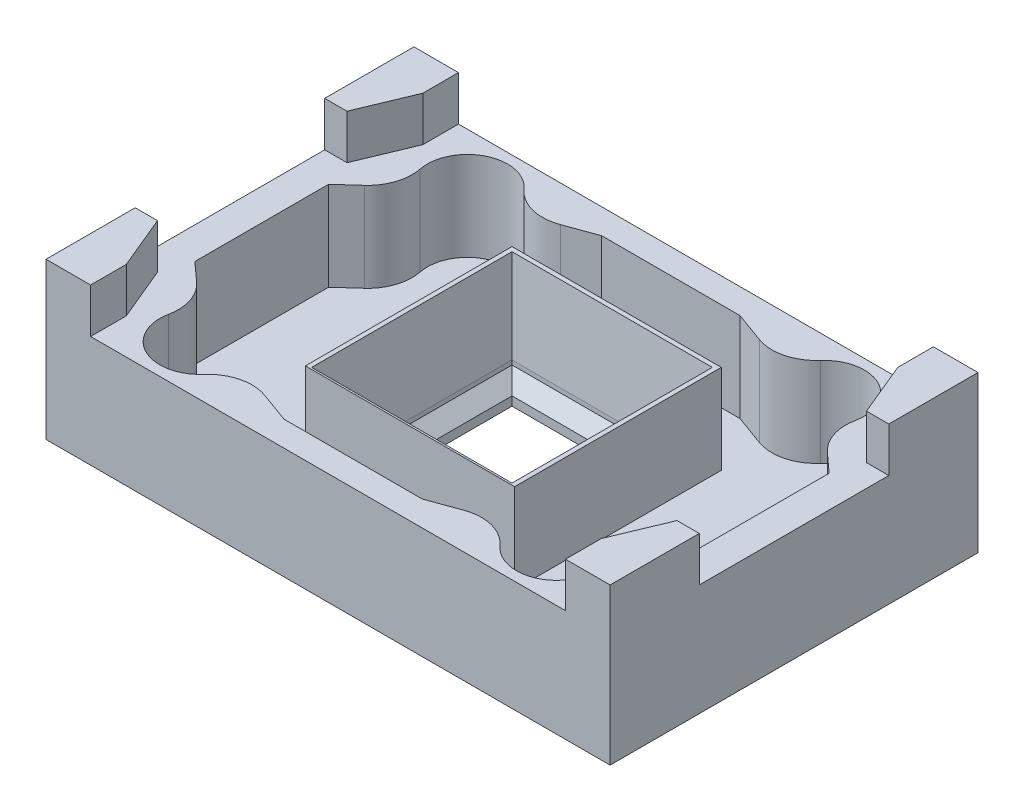
from build123d import *

# Parameters (mm, degrees)
SKETCH_1_W      = 126.5
SKETCH_1_H      = 82.5
SKETCH_1_R      = 2.1
SKETCH_1_R_2    = 1.93578743
SKETCH_1_W_2    = 34.92820323
SKETCH_1_H_2    = 34.928203231
EXTRUDE_1_DEPTH = 5
SKETCH_2_W      = 126.5
SKETCH_2_H      = 82.5
EXTRUDE_2_DEPTH = 20
FILLET_1_R      = 10
CHAMFER_1_SIZE  = 3
SKETCH_3_W      = 46.92820323
SKETCH_3_H      = 46.337518094
SKETCH_3_W_2    = 40.92820323
SKETCH_3_H_2    = 40.928203231
EXTRUDE_3_DEPTH = 20
CHAMFER_2_SIZE  = 2
CHAMFER_2_SIZE2 = 19.028728908
EXTRUDE_4_DEPTH = 10


with BuildPart() as part:
    # Эскиз1 → Бобышка-Вытянуть1 (new body)
    with BuildSketch(Plane(origin=(0, 77.195974268, 0), x_dir=(1, 0, 0), z_dir=(0, 1, 0))):
        with Locations((64.808980694, -89.523129836)):
            Rectangle(SKETCH_1_W, SKETCH_1_H)
        with Locations(Location((24.808980694, -59.523129836, 0), (0, 0, 180))):
            Circle(SKETCH_1_R, mode=Mode.SUBTRACT)
        with Locations(Location((104.808980694, -59.523129836, 0), (0, 0, 180))):
            Circle(SKETCH_1_R, mode=Mode.SUBTRACT)
        with Locations(Location((104.808980694, -119.523129836, 0), (0, 0, 180))):
            Circle(SKETCH_1_R_2, mode=Mode.SUBTRACT)
        with Locations(Location((24.808980694, -119.523129836, 0), (0, 0, 180))):
            Circle(SKETCH_1_R, mode=Mode.SUBTRACT)
        with Locations((64.808980694, -89.523129837)):
            Rectangle(SKETCH_1_W_2, SKETCH_1_H_2, mode=Mode.SUBTRACT)
    extrude(amount=EXTRUDE_1_DEPTH)

    # Эскиз2 → Бобышка-Вытянуть2 (add)
    with BuildSketch(Plane(origin=(0, 82.195974268, 0), x_dir=(1, 0, 0), z_dir=(0, 1, 0))):
        with Locations((64.808980694, -89.523129836)):
            Rectangle(SKETCH_2_W, SKETCH_2_H)
        with BuildLine():
            ThreePointArc((18.350983106, -65.791643787), (21.426820016, -51.182806752), (33.808980694, -59.523129836))
            Line((33.808980694, -59.523129836), (49.308980694, -53.898129836))
            Line((49.308980694, -53.898129836), (80.308980694, -53.898129836))
            Line((80.308980694, -53.898129836), (95.808980694, -59.523129836))
            ThreePointArc((95.808980694, -59.523129836), (104.808980694, -50.523129836), (113.808980694, -59.523129836))
            ThreePointArc((113.808980694, -59.523129836), (113.149303778, -62.905290515), (111.266978282, -65.791643787))
            Line((111.266978282, -65.791643787), (120.933980694, -74.523129836))
            Line((120.933980694, -74.523129836), (120.933980694, -104.523129836))
            Line((120.933980694, -104.523129836), (111.266978282, -113.254615886))
            ThreePointArc((111.266978282, -113.254615886), (113.149303778, -116.140969158), (113.808980694, -119.523129836))
            ThreePointArc((113.808980694, -119.523129836), (104.808980694, -128.523129836), (95.808980694, -119.523129836))
            Line((95.808980694, -119.523129836), (80.308980694, -125.148129836))
            Line((80.308980694, -125.148129836), (49.308980694, -125.148129836))
            Line((49.308980694, -125.148129836), (33.808980694, -119.523129836))
            ThreePointArc((33.808980694, -119.523129836), (21.426820016, -127.86345292), (18.350983106, -113.254615886))
            Line((18.350983106, -113.254615886), (8.683980694, -104.523129836))
            Line((8.683980694, -104.523129836), (8.683980694, -74.523129836))
            Line((8.683980694, -74.523129836), (18.350983106, -65.791643787))
        make_face(mode=Mode.SUBTRACT)
    extrude(amount=EXTRUDE_2_DEPTH)

    # Скругление1
    fillet_1_edges = [part.edges().sort_by_distance(p)[0] for p in [
        (18.350983106, 92.195974268, 65.791643787),
        (33.808980694, 92.195974268, 59.523129836),
        (95.808980694, 92.195974268, 59.523129836),
        (111.266978282, 92.195974268, 65.791643787),
        (111.266978282, 92.195974268, 113.254615886),
        (95.808980694, 92.195974268, 119.523129836),
        (33.808980694, 92.195974268, 119.523129836),
        (18.350983106, 92.195974268, 113.254615886),
    ]]
    fillet(fillet_1_edges, radius=FILLET_1_R)

    # Фаска1
    chamfer_1_edges = [part.edges().sort_by_distance(p)[0] for p in [
        (64.808980694, 82.195974268, 72.059028221),
        (47.344879079, 82.195974268, 89.523129836),
        (64.808980694, 82.195974268, 106.987231452),
        (82.273082309, 82.195974268, 89.523129836),
    ]]
    chamfer(chamfer_1_edges, length=CHAMFER_1_SIZE)

    # Эскиз3 → Бобышка-Вытянуть3 (add)
    with BuildSketch(Plane(origin=(0, 82.195974268, 0), x_dir=(1, 0, 0), z_dir=(0, 1, 0))):
        with Locations((64.808980694, -89.227787268)):
            Rectangle(SKETCH_3_W, SKETCH_3_H)
        with Locations((64.808980694, -89.523129837)):
            Rectangle(SKETCH_3_W_2, SKETCH_3_H_2, mode=Mode.SUBTRACT)
    extrude(amount=EXTRUDE_3_DEPTH)

    # Фаска2
    chamfer_2_edges = [part.edges().sort_by_distance(p)[0] for p in [
        (64.808980694, 102.195974268, 69.059028221),
        (44.344879079, 102.195974268, 89.523129836),
        (64.808980694, 102.195974268, 109.987231452),
        (85.273082309, 102.195974268, 89.523129836),
    ]]
    chamfer_2_side = [part.faces().sort_by_distance(p)[0] for p in [
        (64.808980694, 102.195974268, 66.718529688),
    ]]
    chamfer(chamfer_2_edges, length=CHAMFER_2_SIZE, length2=CHAMFER_2_SIZE2, reference=chamfer_2_side[0])

    # Эскиз4 → Бобышка-Вытянуть4 (add)
    with BuildSketch(Plane(origin=(0, 102.195974268, 0), x_dir=(1, 0, 0), z_dir=(0, 1, 0))):
        Polygon((1.558980694, -48.273129836), (1.558980694, -68.273129836), (6.558980694, -68.273129836), (11.558980694, -56.273129836), (11.558980694, -48.273129836), align=None)
        Polygon((128.058980694, -48.273129836), (118.058980694, -48.273129836), (118.058980694, -56.273129836), (123.058980694, -68.273129836), (128.058980694, -68.273129836), align=None)
        Polygon((128.058980694, -130.773129836), (118.058980694, -130.773129836), (118.058980694, -122.773129836), (123.058980694, -110.773129836), (128.058980694, -110.773129836), align=None)
        Polygon((1.558980694, -130.773129836), (11.558980694, -130.773129836), (11.558980694, -122.773129836), (6.558980694, -110.773129836), (1.558980694, -110.773129836), align=None)
    extrude(amount=EXTRUDE_4_DEPTH)


solid = part.part
